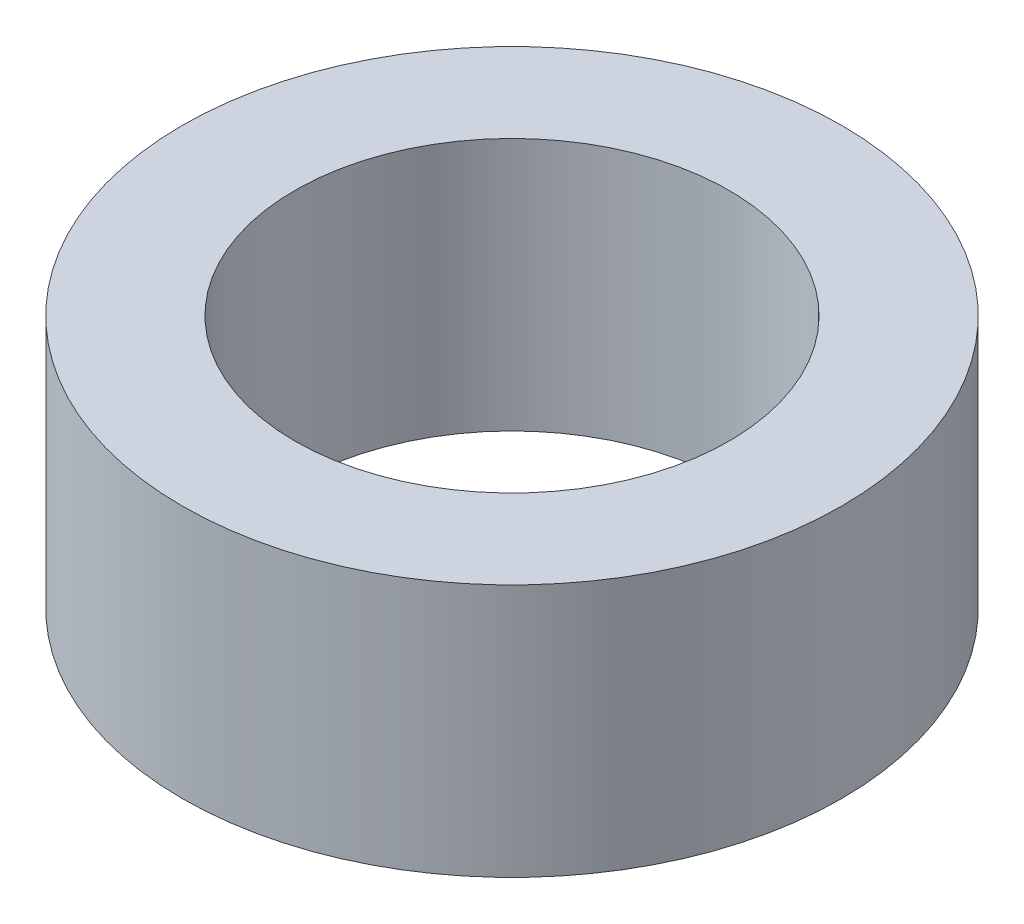
from build123d import *

# Parameters (mm, degrees)
SKETCH1_R           = 5.58
SKETCH1_R_2         = 3.675
BOSS_EXTRUDE1_DEPTH = 4.2875


with BuildPart() as part:
    # Sketch1 → Boss-Extrude1 (new body)
    with BuildSketch(Plane(origin=(0, 0, 0), x_dir=(1, 0, 0), z_dir=(0, 1, 0))):
        with Locations(Location((0, 0, 0), (0, 0, 270))):
            Circle(SKETCH1_R)
        with Locations(Location((0, 0, 0), (0, 0, 270))):
            Circle(SKETCH1_R_2, mode=Mode.SUBTRACT)
    extrude(amount=BOSS_EXTRUDE1_DEPTH)


solid = part.part
